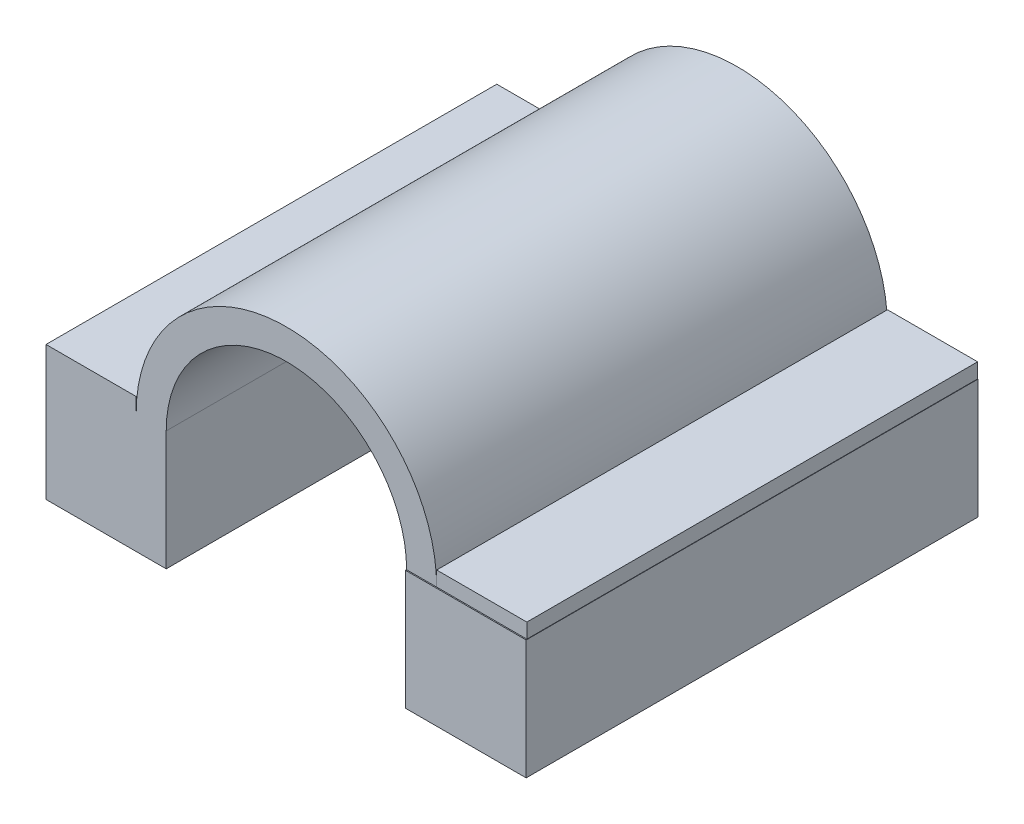
from build123d import *

# Parameters (mm, degrees)
EXTRUDE_THIN1_DEPTH = 30
SKETCH2_W           = 30
SKETCH2_H           = 0.984822369
BOSS_EXTRUDE1_DEPTH = 6
SKETCH3_W           = 30
SKETCH3_H           = 0.984822369
BOSS_EXTRUDE2_DEPTH = 6
SKETCH7_W           = 8.024735178
SKETCH7_H           = 30.071065223
BOSS_EXTRUDE3_DEPTH = 7.95
SKETCH9_W           = 8
SKETCH9_H           = 30
BOSS_EXTRUDE5_DEPTH = 7.95


with BuildPart() as part:
    # Sketch1 → Extrude-Thin1 (new body)
    with BuildSketch(Plane.XY):
        with BuildLine():
            ThreePointArc((8, 0), (0, 8), (-8, 0))
            Line((-8, 0), (-10, 0))
            ThreePointArc((-10, 0), (0, 10), (10, 0))
            Line((10, 0), (8, 0))
        make_face()
    extrude(amount=EXTRUDE_THIN1_DEPTH)



with BuildPart() as body_2:
    # Sketch2 → Boss-Extrude1 (new body)
    with BuildSketch(Plane.ZY.offset(10)):
        with Locations((15, 0.492411185)):
            Rectangle(SKETCH2_W, SKETCH2_H)
    extrude(amount=BOSS_EXTRUDE1_DEPTH)


with BuildPart() as body_3:
    # Sketch3 → Boss-Extrude2 (new body)
    with BuildSketch(Plane(origin=(10, 0, 0), x_dir=(0, 0, -1), z_dir=(1, 0, 0))):
        with Locations((-15, 0.492411185)):
            Rectangle(SKETCH3_W, SKETCH3_H)
    extrude(amount=BOSS_EXTRUDE2_DEPTH)


with BuildPart() as part_1:
    add(part.part)

    add(body_3.part)  # Boss-Extrude3 merges body 3
    # Sketch7 → Boss-Extrude3 (add)
    with BuildSketch(Plane(origin=(0, 0, 0), x_dir=(1, 0, 0), z_dir=(0, 1, 0))):
        with Locations((12.012367589, -15.035532612)):
            Rectangle(SKETCH7_W, SKETCH7_H)
    extrude(amount=-BOSS_EXTRUDE3_DEPTH)


    add(body_2.part)  # Boss-Extrude5 merges body 2
    # Sketch9 → Boss-Extrude5 (add)
    with BuildSketch(Plane.XZ):
        with Locations((-12, 15)):
            Rectangle(SKETCH9_W, SKETCH9_H)
    extrude(amount=BOSS_EXTRUDE5_DEPTH)


solid = part_1.part
